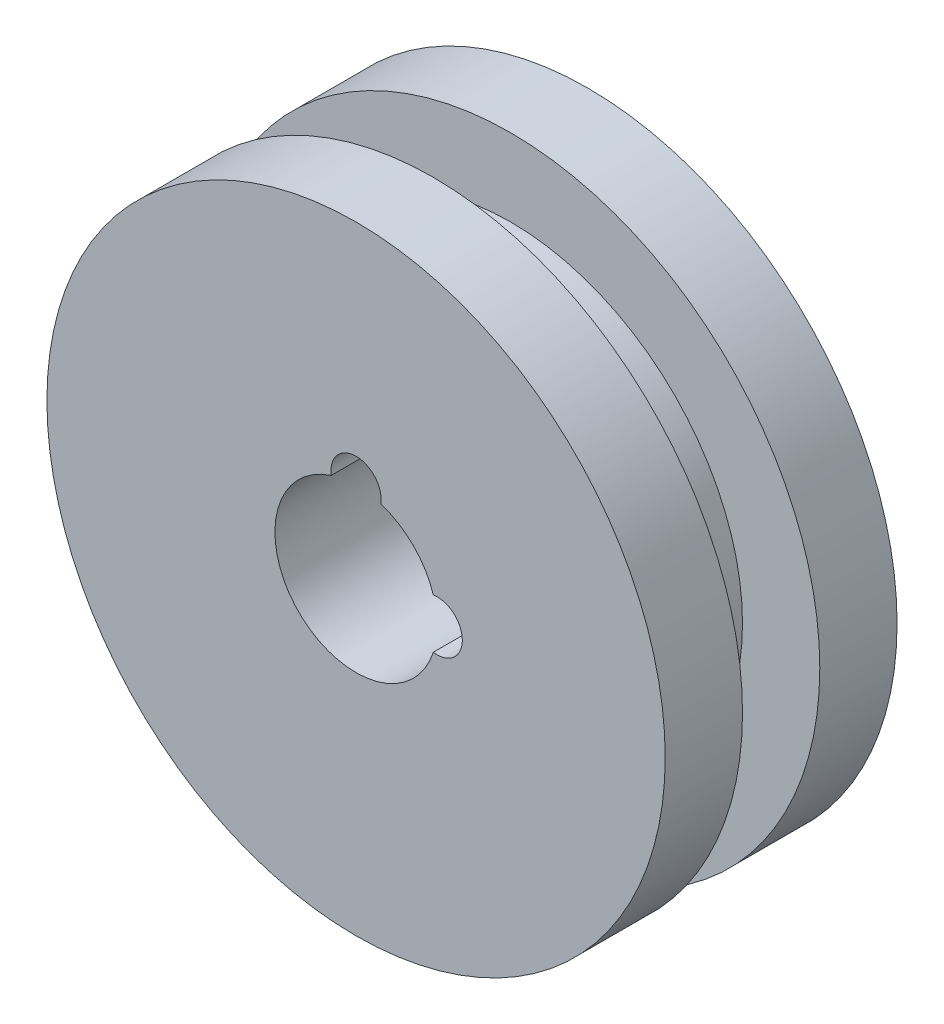
from build123d import *

# Parameters (mm, degrees)
ESQUISSE1_R        = 6
BOSS_EXTRU_1_DEPTH = 3
ESQUISSE2_R        = 8
ESQUISSE2_R_2      = 6
BOSS_EXTRU_2_DEPTH = 2


with BuildPart() as part:
    # Esquisse1 → Boss.-Extru.1 (new, symmetric)
    with BuildSketch(Plane.XY):
        Circle(ESQUISSE1_R)
        with BuildLine():
            ThreePointArc((-0.642168668, 1.999404762), (-1.48492424, -1.48492424), (1.999404762, -0.642168668))
            ThreePointArc((1.999404762, -0.642168668), (2.75, 0), (1.999404762, 0.642168668))
            ThreePointArc((1.999404762, 0.642168668), (1.48492424, 1.48492424), (0.642168668, 1.999404762))
            ThreePointArc((0.642168668, 1.999404762), (0, 2.75), (-0.642168668, 1.999404762))
        make_face(mode=Mode.SUBTRACT)
    extrude(amount=BOSS_EXTRU_1_DEPTH, both=True)

    # Esquisse2 → Boss.-Extru.2 (add)
    with BuildSketch(Plane.XY.offset(3)):
        Circle(ESQUISSE2_R)
        Circle(ESQUISSE2_R_2, mode=Mode.SUBTRACT)
    boss_extru_2 = extrude(amount=-BOSS_EXTRU_2_DEPTH)

    # Symétrie1: Boss.-Extru.2 across plane
    add(boss_extru_2.mirror(Plane.XY))


solid = part.part
